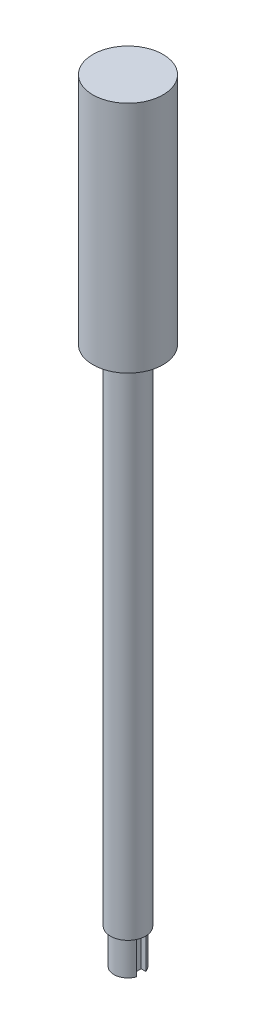
from build123d import *

# Parameters (mm, degrees)
SKETCH1_R           = 7.5
BOSS_EXTRUDE1_DEPTH = 215.44
SKETCH5_R           = 15
BOSS_EXTRUDE5_DEPTH = 5
SKETCH6_R           = 15
SKETCH6_R_2         = 12.5
BOSS_EXTRUDE6_DEPTH = 90
SKETCH7_R           = 15
BOSS_EXTRUDE7_DEPTH = 5
FILLET2_R           = 2
SKETCH9_R           = 6
BOSS_EXTRUDE9_DEPTH = 15
SKETCH12_W          = 15.293303155
SKETCH12_H          = 4
CUT_EXTRUDE3_DEPTH  = 15


with BuildPart() as part:
    # Sketch1 → Boss-Extrude1 (new body)
    with BuildSketch(Plane(origin=(0, 0, 0), x_dir=(1, 0, 0), z_dir=(0, 1, 0))):
        with Locations(Location((0, 0, 0), (0, 0, 270))):
            Circle(SKETCH1_R)
    extrude(amount=BOSS_EXTRUDE1_DEPTH)

    # Sketch5 → Boss-Extrude5 (add)
    with BuildSketch(Plane(origin=(0, 215.44, 0), x_dir=(1, 0, 0), z_dir=(0, 1, 0))):
        with Locations(Location((0, 0, 0), (0, 0, 270))):
            Circle(SKETCH5_R)
    extrude(amount=BOSS_EXTRUDE5_DEPTH)

    # Sketch6 → Boss-Extrude6 (add)
    with BuildSketch(Plane(origin=(0, 220.44, 0), x_dir=(1, 0, 0), z_dir=(0, 1, 0))):
        with Locations(Location((0, 0, 0), (0, 0, 270))):
            Circle(SKETCH6_R)
        with Locations(Location((0, 0, 0), (0, 0, 90))):
            Circle(SKETCH6_R_2, mode=Mode.SUBTRACT)
    extrude(amount=BOSS_EXTRUDE6_DEPTH)

    # Sketch7 → Boss-Extrude7 (add)
    with BuildSketch(Plane(origin=(0, 310.44, 0), x_dir=(1, 0, 0), z_dir=(0, 1, 0))):
        with Locations(Location((0, 0, 0), (0, 0, 270))):
            Circle(SKETCH7_R)
    extrude(amount=BOSS_EXTRUDE7_DEPTH)

    # Fillet2
    fillet2_edges = [part.edges().sort_by_distance(p)[0] for p in [
        (0, 215.44, -7.5),
    ]]
    fillet(fillet2_edges, radius=FILLET2_R)

    # Sketch9 → Boss-Extrude9 (add)
    with BuildSketch(Plane.XZ):
        with Locations(Location((0, 0, 0), (0, 0, 90))):
            Circle(SKETCH9_R)
    extrude(amount=BOSS_EXTRUDE9_DEPTH)

    # Sketch12 → Cut-Extrude3 (cut)
    with BuildSketch(Plane.XZ.offset(15)):
        with Locations((11.306651578, 0)):
            Rectangle(SKETCH12_W, SKETCH12_H)
    extrude(amount=-CUT_EXTRUDE3_DEPTH, mode=Mode.SUBTRACT)


solid = part.part
